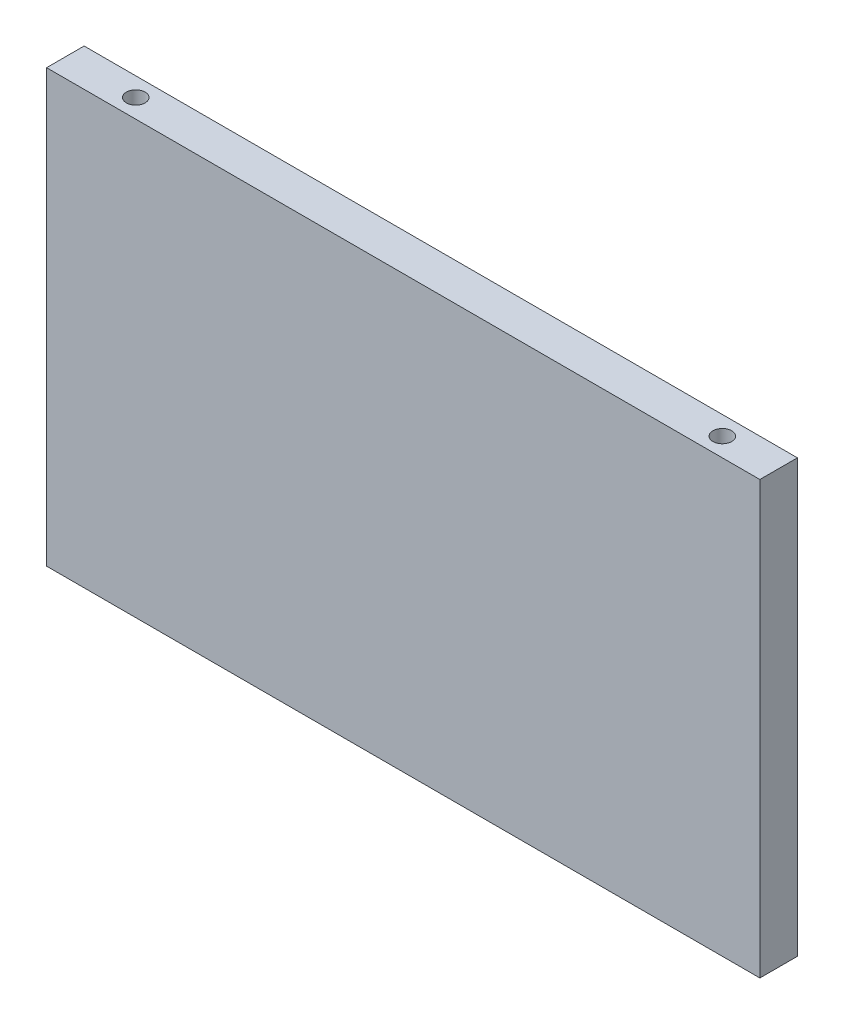
from build123d import *

# Parameters (mm, degrees)
ESQUISSE1_W             = 152
ESQUISSE1_H             = 92
BOSS_EXTRU_1_DEPTH      = 8
ESQUISSE2_R             = 2
ENL_V_MAT_EXTRU_1_DEPTH = 120.599331102


with BuildPart() as part:
    # Esquisse1 → Boss.-Extru.1 (new body)
    with BuildSketch(Plane.XY):
        Rectangle(ESQUISSE1_W, ESQUISSE1_H)
    extrude(amount=BOSS_EXTRU_1_DEPTH)

    # Esquisse2 → Enlèv. mat.-Extru.1 (cut, through all)
    with BuildSketch(Plane.XZ.offset(46)):
        with Locations((64, 4)):
            Circle(ESQUISSE2_R)
        with Locations((-61, 4)):
            Circle(ESQUISSE2_R)
    extrude(amount=-ENL_V_MAT_EXTRU_1_DEPTH, mode=Mode.SUBTRACT)


solid = part.part
